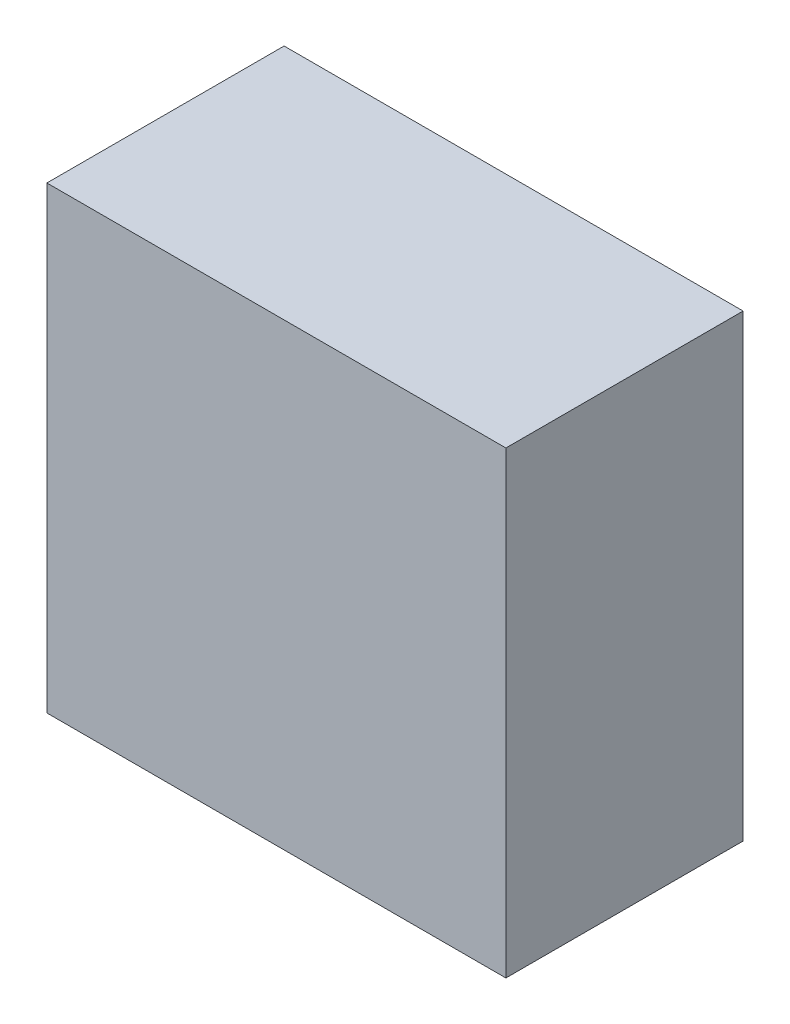
from build123d import *

# Parameters (mm, degrees)
SKETCH1_W           = 40.15
SKETCH1_H           = 40.15
BOSS_EXTRUDE1_DEPTH = 20.75


with BuildPart() as part:
    # Sketch1 → Boss-Extrude1 (new body)
    with BuildSketch(Plane.XY):
        with Locations((20.075, 20.075)):
            Rectangle(SKETCH1_W, SKETCH1_H)
    extrude(amount=BOSS_EXTRUDE1_DEPTH)


solid = part.part
